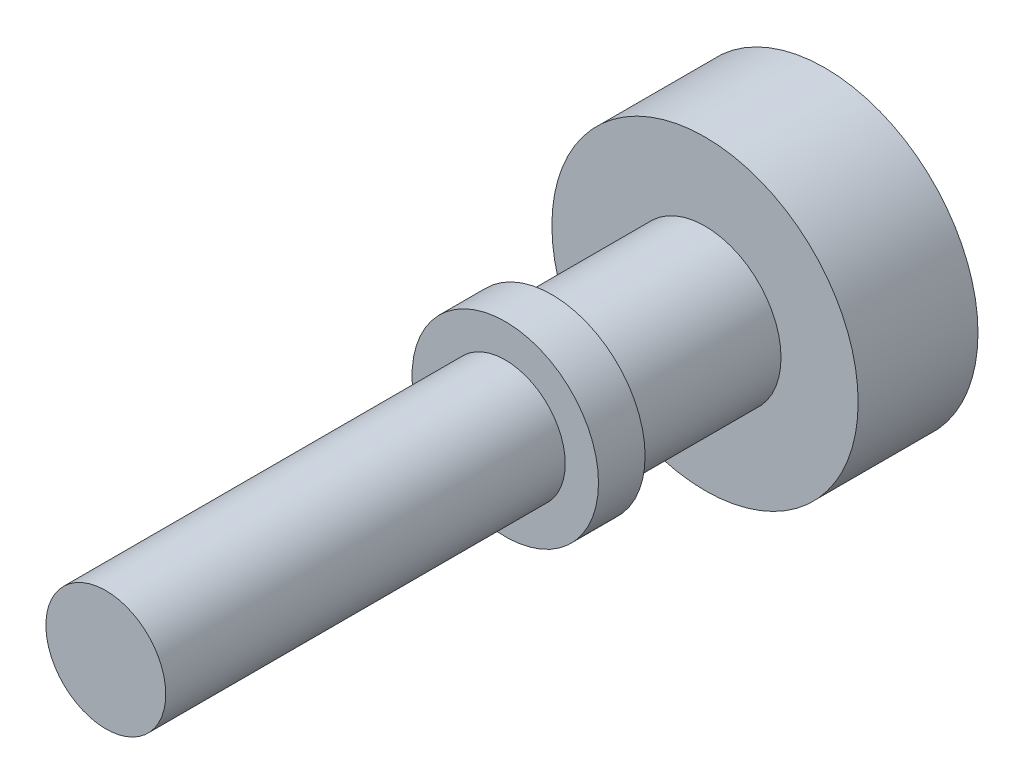
from build123d import *

# Parameters (mm, degrees)
SKETCH1_R           = 5.75
BOSS_EXTRUDE1_DEPTH = 4.5
SKETCH2_R           = 2.853617745
BOSS_EXTRUDE2_DEPTH = 5.75
SKETCH3_R           = 3.5
BOSS_EXTRUDE3_DEPTH = 1.75
SKETCH4_R           = 2.25
BOSS_EXTRUDE4_DEPTH = 15


with BuildPart() as part:
    # Sketch1 → Boss-Extrude1 (new body)
    with BuildSketch(Plane.XY):
        Circle(SKETCH1_R)
    extrude(amount=BOSS_EXTRUDE1_DEPTH)

    # Sketch2 → Boss-Extrude2 (add)
    with BuildSketch(Plane.XY.offset(4.5)):
        Circle(SKETCH2_R)
    extrude(amount=BOSS_EXTRUDE2_DEPTH)

    # Sketch3 → Boss-Extrude3 (add)
    with BuildSketch(Plane.XY.offset(10.25)):
        Circle(SKETCH3_R)
    extrude(amount=BOSS_EXTRUDE3_DEPTH)

    # Sketch4 → Boss-Extrude4 (add)
    with BuildSketch(Plane.XY.offset(12)):
        Circle(SKETCH4_R)
    extrude(amount=BOSS_EXTRUDE4_DEPTH)


solid = part.part
